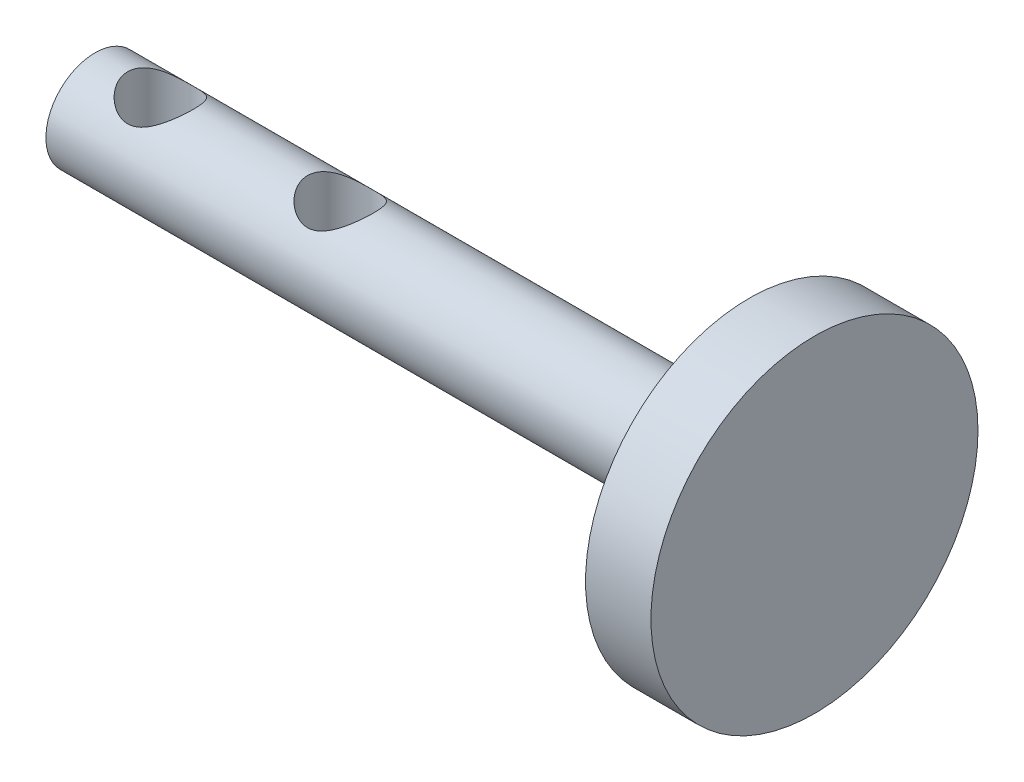
from build123d import *

# Parameters (mm, degrees)
SKETCH1_R               = 1.5
BOSS_EXTRUDE4_DEPTH     = 20
SKETCH5_R               = 5
BOSS_EXTRUDE5_DEPTH     = 2
CUT_EXTRUDE1_DEPTH      = 24.108440017
CUT_EXTRUDE1_DEPTH_BACK = 24.108440017
SKETCH6_R               = 1


with BuildPart() as part:
    # Sketch1 → Boss-Extrude4 (new body)
    with BuildSketch(Plane(origin=(0, 0, 0), x_dir=(0, 0, -1), z_dir=(1, 0, 0))):
        Circle(SKETCH1_R)
    extrude(amount=BOSS_EXTRUDE4_DEPTH)

    # Sketch5 → Boss-Extrude5 (add)
    with BuildSketch(Plane(origin=(20, 0, 0), x_dir=(0, 0, -1), z_dir=(1, 0, 0))):
        Circle(SKETCH5_R)
    extrude(amount=BOSS_EXTRUDE5_DEPTH)

    # Sketch6 → Cut-Extrude1 (cut, two sides: drawn at the far end of the back side and taken through both)
    with BuildSketch(Plane(origin=(0, 0, 0), x_dir=(1, 0, 0), z_dir=(0, 1, 0)).offset(-CUT_EXTRUDE1_DEPTH_BACK)):
        with Locations(Location((2, 0, 0), (0, 0, 270))):
            Circle(SKETCH6_R)
        with Locations(Location((7.5, 0, 0), (0, 0, 270))):
            Circle(SKETCH6_R)
    extrude(amount=CUT_EXTRUDE1_DEPTH + CUT_EXTRUDE1_DEPTH_BACK, mode=Mode.SUBTRACT)


solid = part.part
